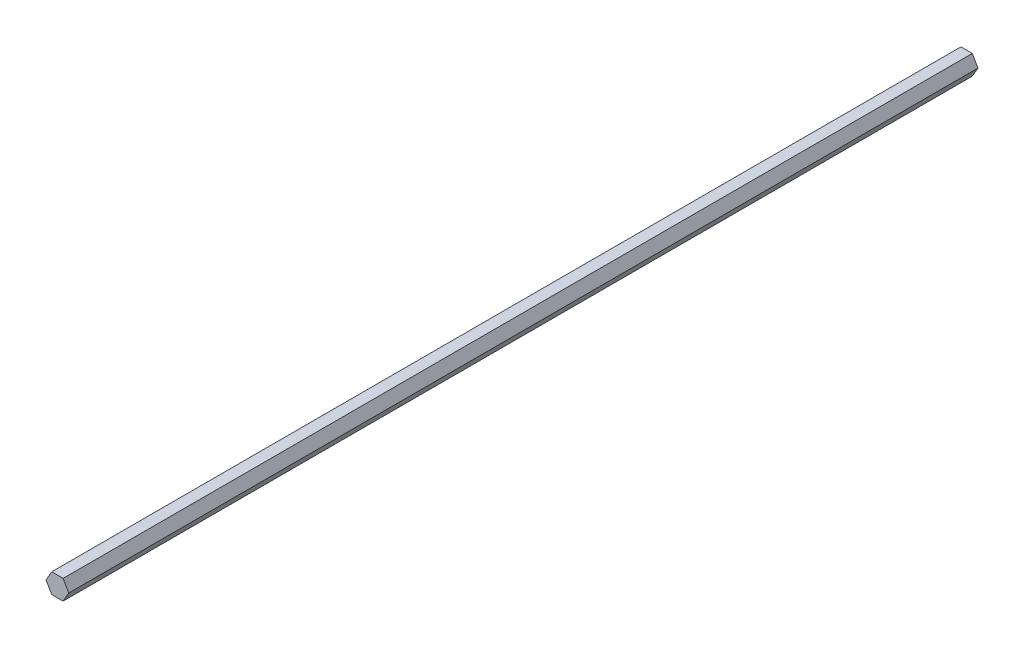
from build123d import *

# Parameters (mm, degrees)
BOSS_EXTRUDE1_DEPTH = 292.89375


with BuildPart() as part:
    # Sketch1 → Boss-Extrude1 (new, symmetric)
    with BuildSketch(Plane.XY):
        Polygon((3.666174209, -6.35), (7.332348419, 0), (3.666174209, 6.35), (-3.666174209, 6.35), (-7.332348419, 0), (-3.666174209, -6.35), align=None)
    extrude(amount=BOSS_EXTRUDE1_DEPTH, both=True)


solid = part.part
